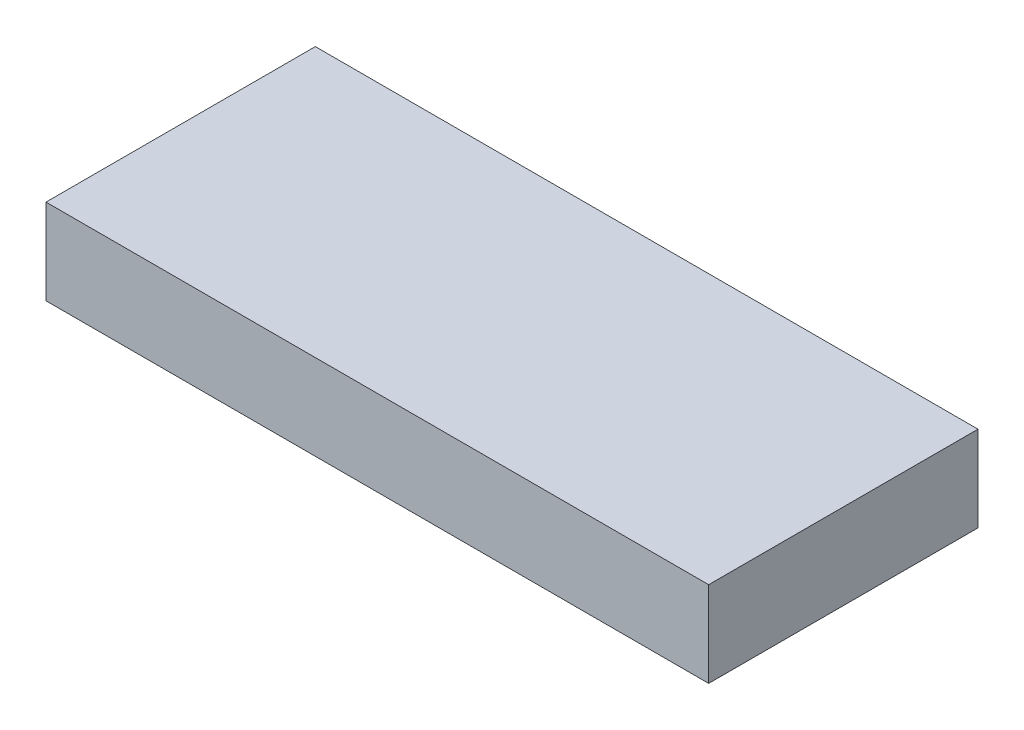
from build123d import *

# Parameters (mm, degrees)
SKETCH1_W           = 31
SKETCH1_H           = 4
BOSS_EXTRUDE1_DEPTH = 12.6


with BuildPart() as part:
    # Sketch1 → Boss-Extrude1 (new body)
    with BuildSketch(Plane.XY):
        with Locations((-11.451492537, 14.251865672)):
            Rectangle(SKETCH1_W, SKETCH1_H)
    extrude(amount=BOSS_EXTRUDE1_DEPTH)


solid = part.part
